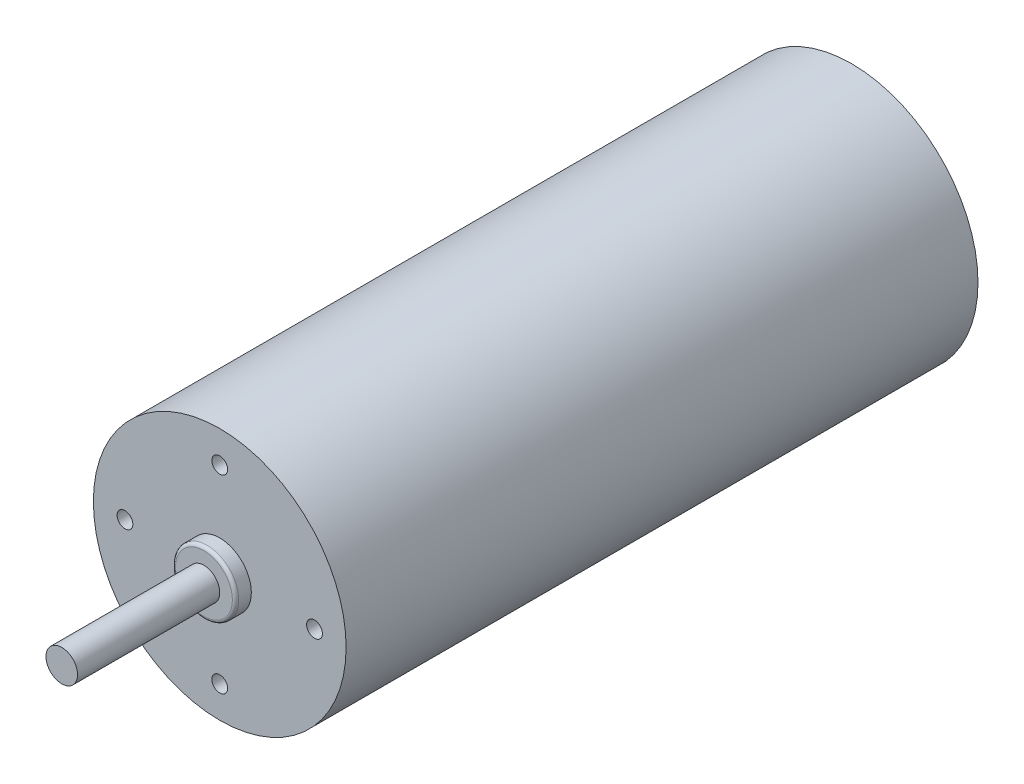
from build123d import *

# Parameters (mm, degrees)
SKETCH1_R           = 4
BOSS_EXTRUDE1_DEPTH = 20
SKETCH2_R           = 1
SKETCH2_R_2         = 0.5
BOSS_EXTRUDE2_DEPTH = 0.5
SKETCH4_R           = 0.5
BOSS_EXTRUDE3_DEPTH = 5
FILLET2_R           = 0.1
SKETCH5_R           = 0.25
CUT_EXTRUDE1_DEPTH  = 21.784609691


with BuildPart() as part:
    # Sketch1 → Boss-Extrude1 (new body)
    with BuildSketch(Plane.XY):
        Circle(SKETCH1_R)
    extrude(amount=BOSS_EXTRUDE1_DEPTH)

    # Sketch2 → Boss-Extrude2 (add)
    with BuildSketch(Plane.XY.offset(20)):
        Circle(SKETCH2_R)
        Circle(SKETCH2_R_2, mode=Mode.SUBTRACT)
    extrude(amount=BOSS_EXTRUDE2_DEPTH)

    # Sketch4 → Boss-Extrude3 (add)
    with BuildSketch(Plane.XY.offset(20)):
        Circle(SKETCH4_R)
    extrude(amount=BOSS_EXTRUDE3_DEPTH)

    # Fillet2
    fillet2_edges = [part.edges().sort_by_distance(p)[0] for p in [
        (-1, 0, 20.5),
    ]]
    fillet(fillet2_edges, radius=FILLET2_R)

    # Sketch5 → Cut-Extrude1 (cut, through all)
    with BuildSketch(Plane.XY.offset(20)):
        with Locations((0, 3)):
            Circle(SKETCH5_R)
        with Locations(Location((0, -3, 0), (0, 0, 180))):
            Circle(SKETCH5_R)
        with Locations((3, 0)):
            Circle(SKETCH5_R)
        with Locations(Location((-3, 0, 0), (0, 0, 180))):
            Circle(SKETCH5_R)
    extrude(amount=-CUT_EXTRUDE1_DEPTH, mode=Mode.SUBTRACT)


solid = part.part
